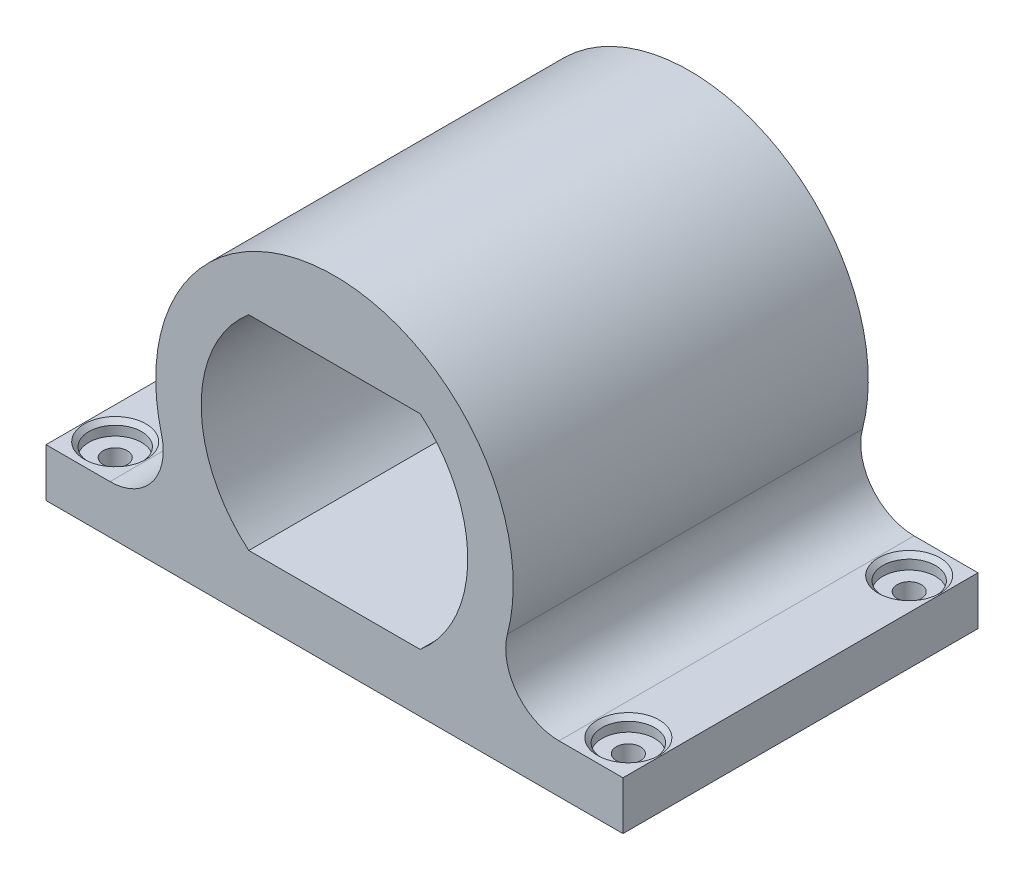
from build123d import *

# Parameters (mm, degrees)
BOSS_EXTRUDE1_DEPTH                         = 50.8
CBORE_FOR_5_BINDING_HEAD_MACHINE_SC_2_COUNT = 2
CBORE_FOR_5_BINDING_HEAD_MACHINE_SC_2_PITCH = 40.189879992
CBORE_FOR_5_BINDING_HEAD_MACHINE_SC_3_COUNT = 2
CBORE_FOR_5_BINDING_HEAD_MACHINE_SC_3_PITCH = 40.181482417


with BuildPart() as part:
    # Sketch1 → Boss-Extrude1 (new body)
    with BuildSketch(Plane.XY):
        with BuildLine():
            Line((41.275, -15.999909517), (41.275, -22.9235))
            Line((41.275, -22.9235), (-41.275, -22.9235))
            Line((-41.275, -22.9235), (-41.275, -16.00020267))
            Line((-41.275, -16.00020267), (-32.120446577, -16.00020267))
            ThreePointArc((-32.120446577, -16.00020267), (-26.090409627, -13.03885638), (-24.747256549, -6.456542406))
            ThreePointArc((-24.747256549, -6.456542406), (0, 25.575645574), (24.747256549, -6.456542406))
            ThreePointArc((24.747256549, -6.456542406), (26.09048422, -13.03895293), (32.120690592, -16.000202666))
            Line((32.120690592, -16.000202666), (41.275, -15.999909517))
        make_face()
        with BuildLine():
            Line((0, 14.605), (12.262196034, 14.605))
            ThreePointArc((12.262196034, 14.605), (19.070067555, 0), (12.262196034, -14.605))
            Line((12.262196034, -14.605), (0, -14.605))
            Line((0, -14.605), (-12.262196034, -14.605))
            ThreePointArc((-12.262196034, -14.605), (-19.070067555, 0), (-12.262196034, 14.605))
            Line((-12.262196034, 14.605), (0, 14.605))
        make_face(mode=Mode.SUBTRACT)
    extrude(amount=BOSS_EXTRUDE1_DEPTH)

    # Sketch6 → CBORE for #5 Binding Head Machine Screw1 (revolve, cut)
    with BuildSketch(Plane(origin=(-36.697723288, -16.00020267, 5.28577815), x_dir=(0, 0, 1), z_dir=(1, 0, 0))):
        Polygon((0, 0), (0, 6.92329733), (1.7272, 6.92329733), (1.7272, 1.9812), (3.77063, 1.9812), (3.77063, 0.635), (4.40563, 0), align=None)
    cbore_for_5_binding_head_machine_screw1 = revolve(axis=Axis((-36.697723288, -9.65020267, 5.28577815), (0, -1, 0)), mode=Mode.SUBTRACT)

    # CBORE for _5 Binding Head Machine Sc 2: CBORE for #5 Binding Head Machine Screw1 ×2
    with Locations(*[(0, 0, i * CBORE_FOR_5_BINDING_HEAD_MACHINE_SC_2_PITCH) for i in range(1, CBORE_FOR_5_BINDING_HEAD_MACHINE_SC_2_COUNT)]):
        add(cbore_for_5_binding_head_machine_screw1, mode=Mode.SUBTRACT)

    # Sketch8 → CBORE for #5 Binding Head Machine Screw2 (revolve, cut)
    with BuildSketch(Plane(origin=(36.697845296, -16.000056092, 5.268033609), x_dir=(-0.9999999994872624, -3.2023045840411235e-05, 0), z_dir=(0, 0, 1))):
        Polygon((0, 0), (0, 6.923590479), (1.7272, 6.923590479), (1.7272, 1.9812), (3.77063, 1.9812), (3.77063, 0.635), (4.40563, 0), align=None)
    cbore_for_5_binding_head_machine_screw2 = revolve(axis=Axis((36.69764195, -9.650056095, 5.268033609), (3.20230458404138e-05, -0.9999999994872623, 0)), mode=Mode.SUBTRACT)

    # CBORE for _5 Binding Head Machine Sc 3: CBORE for #5 Binding Head Machine Screw2 ×2
    with Locations(*[(0, 0, i * CBORE_FOR_5_BINDING_HEAD_MACHINE_SC_3_PITCH) for i in range(1, CBORE_FOR_5_BINDING_HEAD_MACHINE_SC_3_COUNT)]):
        add(cbore_for_5_binding_head_machine_screw2, mode=Mode.SUBTRACT)


solid = part.part
